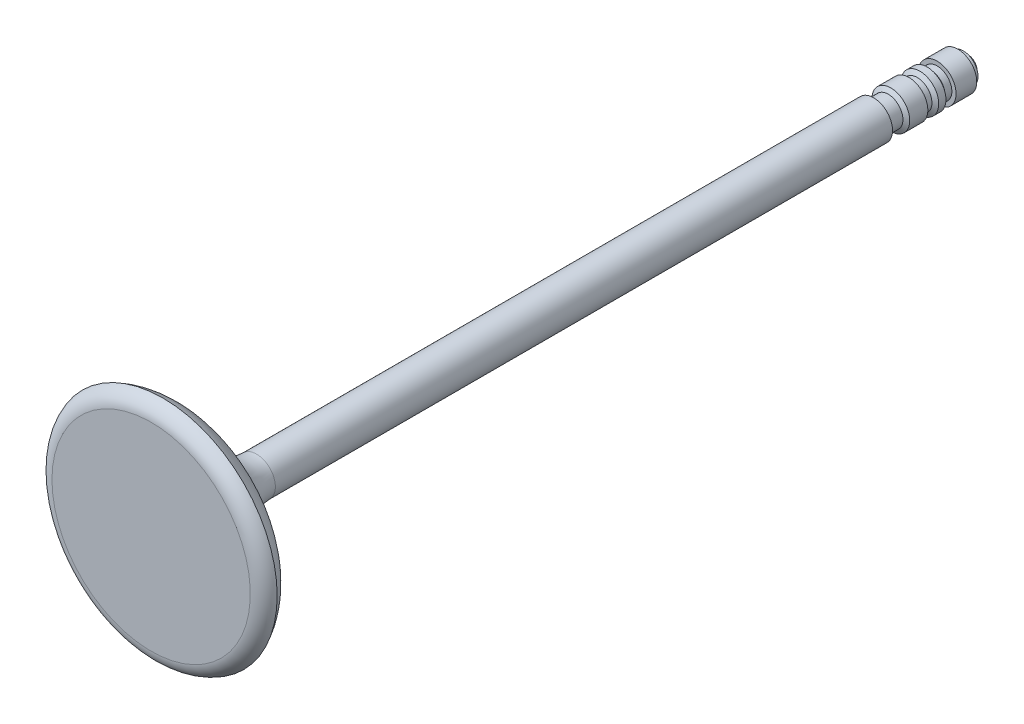
from build123d import *


with BuildPart() as part:
    # Sketch1 → Revolve1 (revolve)
    with BuildSketch(Plane(origin=(0, 0, 0), x_dir=(0, 0, -1), z_dir=(1, 0, 0)), mode=Mode.PRIVATE) as revolve1_sk:
        with BuildLine():
            Line((55.553509337, 0), (-41.692666331, 0))
            Line((-41.692666331, 0), (-41.692666331, 11.814520799))
            ThreePointArc((-41.692666331, 11.814520799), (-41.266642905, 12.931534366), (-40.275497627, 13.6))
            ThreePointArc((-40.275497627, 13.6), (-38.283752535, 11.994111634), (-37.147345345, 9.701841002))
            ThreePointArc((-37.147345345, 9.701841002), (-35.499987602, 6.234951959), (-32.81605757, 3.490935421))
            ThreePointArc((-32.81605757, 3.490935421), (-31.088013134, 2.544687339), (-29.140018683, 2.25))
            Line((-29.140018683, 2.25), (44.382638792, 2.25))
            Line((44.382638792, 2.25), (44.382638792, 1.752462307))
            Line((44.382638792, 1.752462307), (46.11897024, 1.752462307))
            Line((46.11897024, 1.752462307), (46.427430207, 2.25))
            Line((46.427430207, 2.25), (48.58664997, 2.25))
            Line((48.58664997, 2.25), (48.58664997, 1.752462307))
            Line((48.58664997, 1.752462307), (49.573721861, 1.752462307))
            Line((49.573721861, 1.752462307), (49.882181827, 2.25))
            Line((49.882181827, 2.25), (50.745869733, 2.25))
            Line((50.745869733, 2.25), (50.745869733, 2.001231153))
            Line((50.745869733, 2.001231153), (51.147127243, 1.752462307))
            Line((51.147127243, 1.752462307), (51.948863601, 1.752462307))
            Line((51.948863601, 1.752462307), (51.948863601, 2.25))
            Line((51.948863601, 2.25), (54.41654333, 2.25))
            Line((54.41654333, 2.25), (54.41654333, 1.752462307))
            Line((54.41654333, 1.752462307), (55.064309259, 1.752462307))
            Line((55.064309259, 1.752462307), (55.064309259, 1.166388371))
            Line((55.064309259, 1.166388371), (55.553509337, 1.166388371))
            Line((55.553509337, 1.166388371), (55.553509337, 0))
        make_face()
    revolve(revolve1_sk.sketch.rotate(Axis((0, 0, -55.553509337), (0, 0, 1)), 90), axis=Axis((0, 0, -55.553509337), (0, 0, 1)))


solid = part.part
